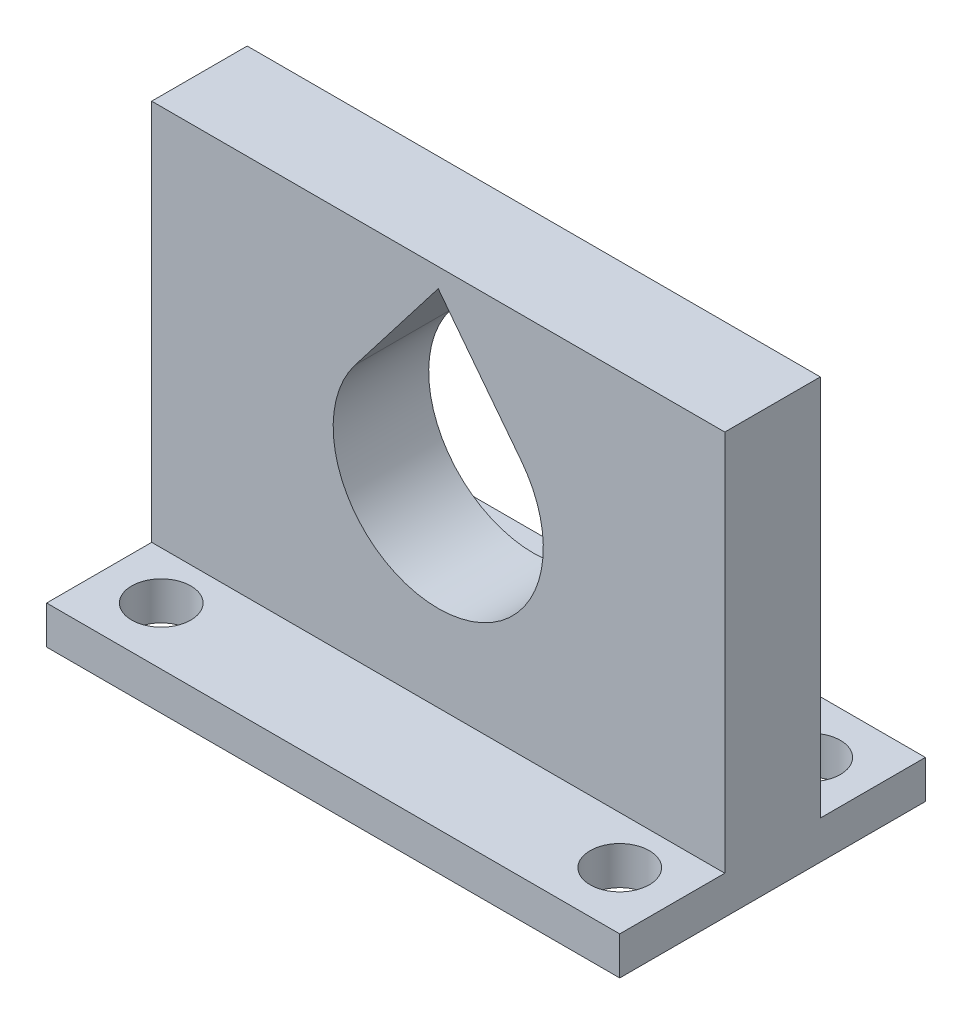
from build123d import *

# Parameters (mm, degrees)
EXTRUDE_1_DEPTH     = 5
SKETCH_2_W          = 15
SKETCH_2_H          = 5
EXTRUDE_3_DEPTH     = 2
SKETCH_4_R          = 1.55
CUT_EXTRUDE_1_DEPTH = 2
SKETCH_7_R          = 5.5
CUT_EXTRUDE_7_DEPTH = 10


with BuildPart() as part:
    # 草图1 → 凸台-拉伸1 (new body)
    with BuildSketch(Plane.XY):
        Polygon((15, 10), (0, 10), (-15, 10), (-15, -10), (15, -10), align=None)
        with BuildLine():
            Line((-4.044639437, 3.577833398), (0, 8.150214535))
            Line((0, 8.150214535), (4.04465135, 3.577819931))
            ThreePointArc((4.04465135, 3.577819931), (5.049807783, 1.912966637), (5.4, 0))
            ThreePointArc((5.4, 0), (-1.912975044, -5.049804598), (-4.044639437, 3.577833398))
        make_face(mode=Mode.SUBTRACT)
    extrude(amount=EXTRUDE_1_DEPTH)

    # 草图2 → 凸台-拉伸3 (add)
    with BuildSketch(Plane.XZ.offset(10)):
        Polygon((15, 0), (0, 0), (-15, 0), (-15, -5.5), (15, -5.5), align=None)
        Polygon((-15, 5), (0, 5), (15, 5), (15, 10.5), (-15, 10.5), align=None)
        with Locations((-7.5, 2.5)):
            Rectangle(SKETCH_2_W, SKETCH_2_H)
        with Locations((7.5, 2.5)):
            Rectangle(SKETCH_2_W, SKETCH_2_H)
    extrude(amount=EXTRUDE_3_DEPTH)

    # 草图4 → 切除-拉伸1 (cut)
    with BuildSketch(Plane(origin=(0, -10, 0), x_dir=(1, 0, 0), z_dir=(0, 1, 0))):
        with BuildLine():
            ThreePointArc((-10.45, 2.5), (-10.903984489, 3.596015511), (-12, 4.05))
            Line((-12, 4.05), (-12, 2.5))
            Line((-12, 2.5), (-13.55, 2.5))
            ThreePointArc((-13.55, 2.5), (-12, 0.95), (-10.45, 2.5))
        make_face()
        with BuildLine():
            Line((-12, 2.5), (-12, 4.05))
            ThreePointArc((-12, 4.05), (-13.096015511, 3.596015511), (-13.55, 2.5))
            Line((-13.55, 2.5), (-12, 2.5))
        make_face()
        with Locations(Location((12, 2.5, 0), (0, 0, 270))):
            Circle(SKETCH_4_R)
        with Locations(Location((12, -7.5, 0), (0, 0, 270))):
            Circle(SKETCH_4_R)
        with Locations(Location((-12, -7.5, 0), (0, 0, 270))):
            Circle(SKETCH_4_R)
    extrude(amount=-CUT_EXTRUDE_1_DEPTH, mode=Mode.SUBTRACT)

    # 草图7 → 切除-拉伸7 (cut)
    with BuildSketch(Plane(origin=(0, 0, 0), x_dir=(-1, 0, 0), z_dir=(0, 0, -1))):
        with BuildLine():
            Line((-3.352919189, 4.359808816), (0, 8.150214535))
            Line((0, 8.150214535), (0, 9))
            Line((0, 9), (-4.326606057, 3.395656052))
            ThreePointArc((-4.326606057, 3.395656052), (-3.869906283, 3.908174172), (-3.352919189, 4.359808816))
        make_face()
        with BuildLine():
            Line((0, 9), (0, 8.150214535))
            Line((0, 8.150214535), (3.352919189, 4.359808816))
            ThreePointArc((3.352919189, 4.359808816), (3.885429206, 3.89274195), (4.353496537, 3.361111111))
            Line((4.353496537, 3.361111111), (0, 9))
        make_face()
        Circle(SKETCH_7_R)
        with BuildLine():
            Line((0, 8.150214535), (4.044639437, 3.577833398))
            ThreePointArc((4.044639437, 3.577833398), (8.99e-06, -5.4), (-4.04465135, 3.577819931))
            Line((-4.04465135, 3.577819931), (0, 8.150214535))
        make_face()
    extrude(amount=-CUT_EXTRUDE_7_DEPTH, mode=Mode.SUBTRACT)


solid = part.part
